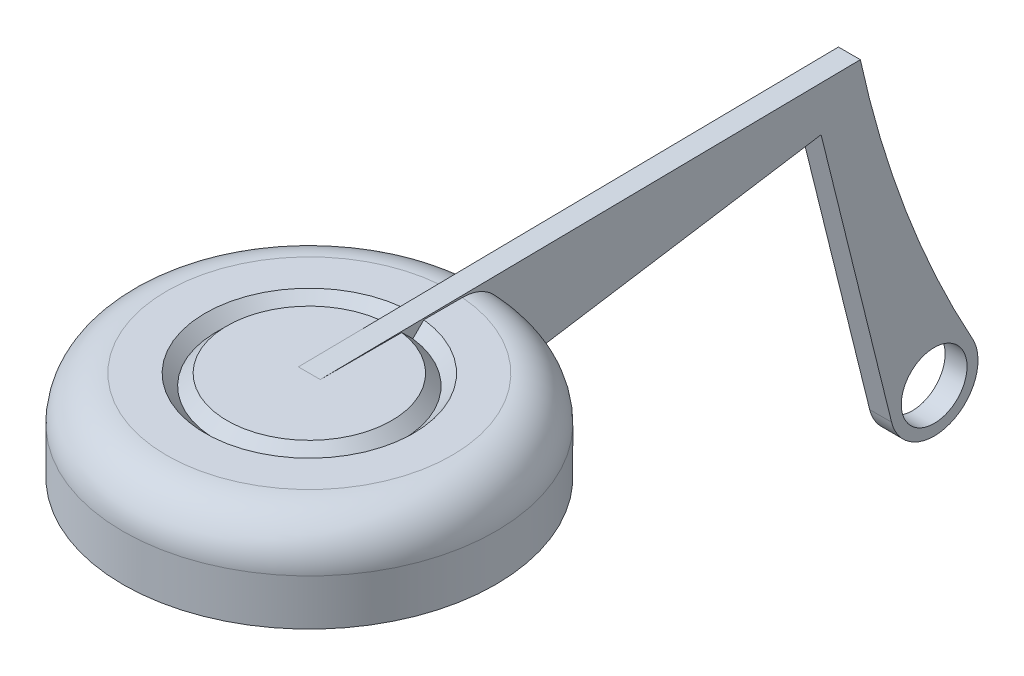
from build123d import *

# Parameters (mm, degrees)
FILLET1_R                = 2
SKETCH5_R                = 8.5
SKETCH5_R_2              = 7
BOSS_EXTRUDE1_DEPTH      = 0.1
BOSS_EXTRUDE2_DEPTH      = 0.5
BOSS_EXTRUDE2_DEPTH_BACK = 0.5
SKETCH6_R                = 1.5


with BuildPart() as part:
    # Sketch4 → Revolve1 (revolve)
    with BuildSketch(Plane(origin=(0, 0, 0), x_dir=(0, 0, -1), z_dir=(1, 0, 0))):
        Polygon((0, 0), (-3.75, 0), (-4.25, -0.5), (-4.75, 0), (-8.5, 0), (-8.5, -4), (0, -4), align=None)
    revolve(axis=Axis((0, 1.890471386, 0), (0, -1, 0)))

    # Fillet1
    fillet1_edges = [part.edges().sort_by_distance(p)[0] for p in [
        (0, 0, -8.5),
    ]]
    fillet(fillet1_edges, radius=FILLET1_R)



with BuildPart() as body_2:
    # Sketch5 → Boss-Extrude1 (new body)
    with BuildSketch(Plane.XZ.offset(4)):
        Circle(SKETCH5_R)
        Circle(SKETCH5_R_2, mode=Mode.SUBTRACT)
    extrude(amount=BOSS_EXTRUDE1_DEPTH)


with BuildPart() as part_1:
    add(part.part)

    add(body_2.part)  # Boss-Extrude2 merges body 2
    # Sketch6 → Boss-Extrude2 (add, two sides: drawn at the far end of the back side and taken through both)
    with BuildSketch(Plane(origin=(0, 0, 0), x_dir=(0, 0, -1), z_dir=(1, 0, 0)).offset(-BOSS_EXTRUDE2_DEPTH_BACK)):
        with BuildLine():
            Line((24.632863069, 0.320027848), (0, 0))
            Line((0, 0), (0, -0.907670556))
            Line((0, -0.907670556), (7.174444166, -0.907670556))
            Line((7.174444166, -0.907670556), (8.5, -4))
            Line((8.5, -4), (22.842383218, -1.748514767))
            Line((22.842383218, -1.748514767), (26.058818057, -14.716497452))
            ThreePointArc((26.058818057, -14.716497452), (28.731556293, -16.096432321), (29.74955993, -13.265987388))
            ThreePointArc((29.74955993, -13.265987388), (26.695705904, -6.6595946), (24.632863069, 0.320027848))
        make_face()
        with Locations((28, -14.235028176)):
            Circle(SKETCH6_R, mode=Mode.SUBTRACT)
    extrude(amount=BOSS_EXTRUDE2_DEPTH + BOSS_EXTRUDE2_DEPTH_BACK)


solid = part_1.part
